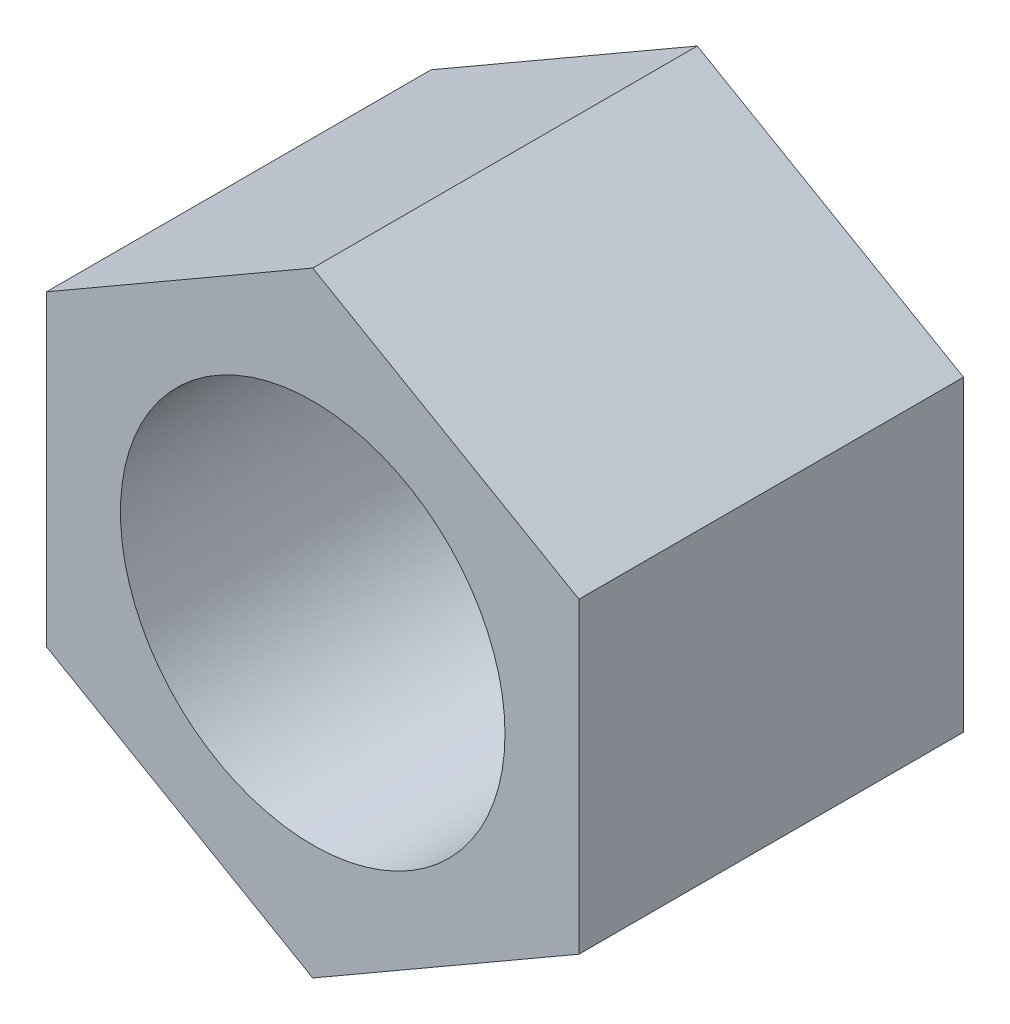
from build123d import *

# Parameters (mm, degrees)
SKETCH1_R           = 1.5
BOSS_EXTRUDE1_DEPTH = 3


with BuildPart() as part:
    # Sketch1 → Boss-Extrude1 (new body)
    with BuildSketch(Plane.XY):
        Polygon((-72.667931354, 82.738667758), (-70.59099365, 83.937788301), (-70.59099365, 86.336029387), (-72.667931354, 87.53514993), (-74.744869059, 86.336029387), (-74.744869059, 83.937788301), align=None)
        with Locations((-72.667931354, 85.136908844)):
            Circle(SKETCH1_R, mode=Mode.SUBTRACT)
    extrude(amount=BOSS_EXTRUDE1_DEPTH)


solid = part.part
